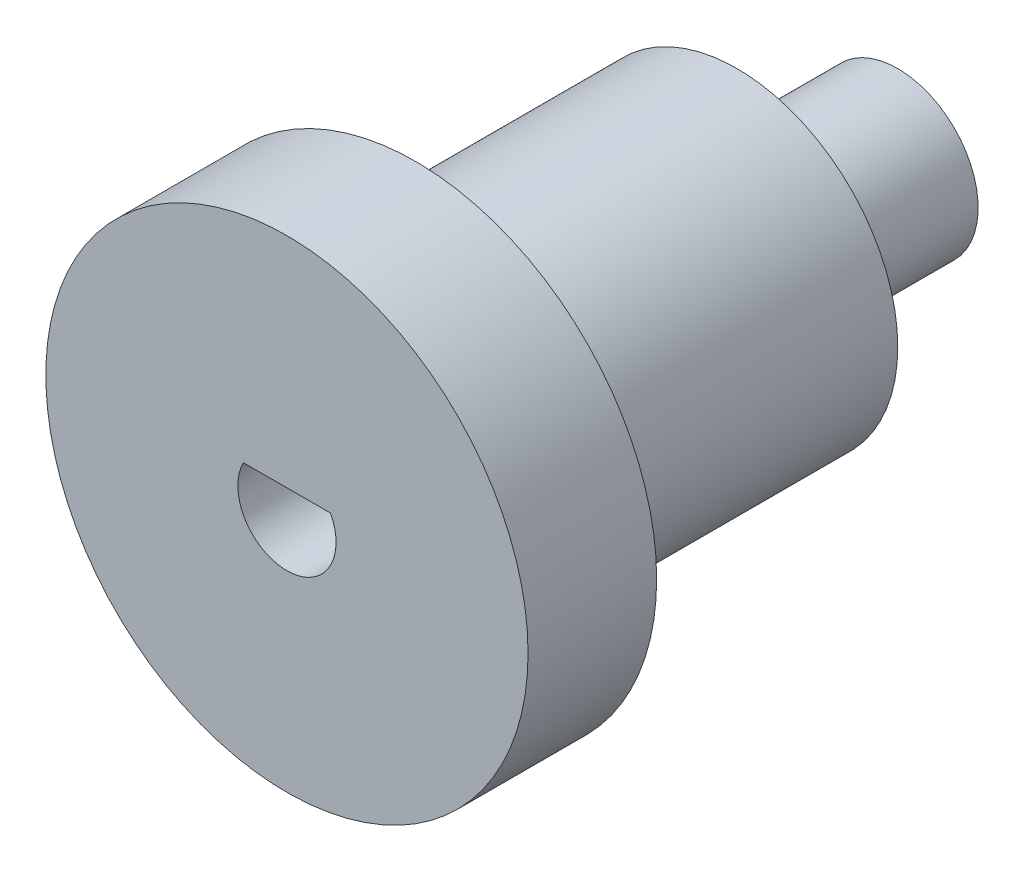
from build123d import *

# Parameters (mm, degrees)
SKETCH1_R           = 9.525
BOSS_EXTRUDE1_DEPTH = 5.08
SKETCH2_R           = 6.35
BOSS_EXTRUDE2_DEPTH = 12.7
SKETCH3_R           = 3.175
BOSS_EXTRUDE3_DEPTH = 6.35


with BuildPart() as part:
    # Sketch1 → Boss-Extrude1 (new body)
    with BuildSketch(Plane.XY):
        Circle(SKETCH1_R)
        with BuildLine():
            Line((-1.721227803, 0.894971982), (1.721227803, 0.894971982))
            ThreePointArc((1.721227803, 0.894971982), (0, -1.94), (-1.721227803, 0.894971982))
        make_face(mode=Mode.SUBTRACT)
    extrude(amount=BOSS_EXTRUDE1_DEPTH)

    # Sketch2 → Boss-Extrude2 (add)
    with BuildSketch(Plane(origin=(0, 0, 0), x_dir=(-1, 0, 0), z_dir=(0, 0, -1))):
        with Locations(Location((0, 0, 0), (0, 0, 180))):
            Circle(SKETCH2_R)
    extrude(amount=BOSS_EXTRUDE2_DEPTH)

    # Sketch3 → Boss-Extrude3 (add)
    with BuildSketch(Plane(origin=(0, 0, -12.7), x_dir=(-1, 0, 0), z_dir=(0, 0, -1))):
        Circle(SKETCH3_R)
    extrude(amount=BOSS_EXTRUDE3_DEPTH)


solid = part.part
